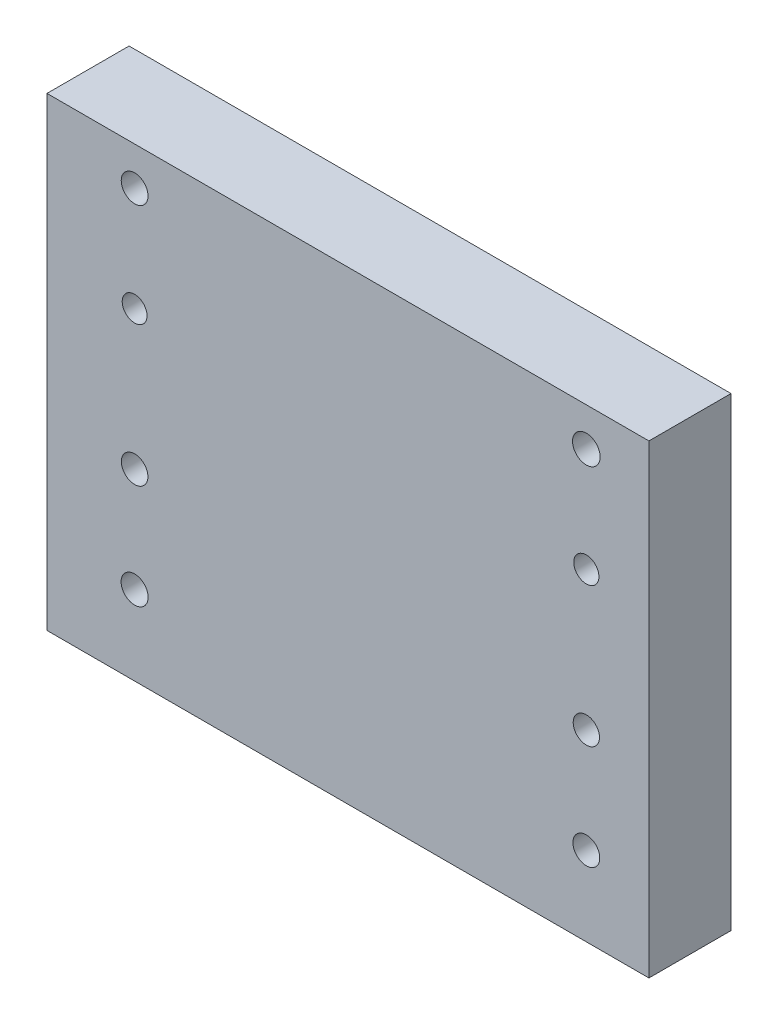
from build123d import *

# Parameters (mm, degrees)
ESQUISSE1_W             = 220
ESQUISSE1_H             = 170
BOSS_EXTRU_1_DEPTH      = 30
ESQUISSE2_R             = 4.903912754
ESQUISSE2_R_2           = 4.801609754
ESQUISSE2_R_3           = 4.59981141
ESQUISSE2_R_4           = 5.047191948
ESQUISSE2_R_5           = 4.896690608
ESQUISSE2_R_6           = 4.540130348
ESQUISSE2_R_7           = 4.855099262
ESQUISSE2_R_8           = 4.939659405
ENL_V_MAT_EXTRU_3_DEPTH = 30


with BuildPart() as part:
    # Esquisse1 → Boss.-Extru.1 (new body)
    with BuildSketch(Plane.XY):
        with Locations((110, 85)):
            Rectangle(ESQUISSE1_W, ESQUISSE1_H)
    extrude(amount=BOSS_EXTRU_1_DEPTH)

    # Esquisse2 → Enlèv. mat.-Extru.3 (cut)
    with BuildSketch(Plane(origin=(0, 0, 0), x_dir=(-1, 0, 0), z_dir=(0, 0, -1))):
        with Locations((-197.125064527, 28.976729825)):
            Circle(ESQUISSE2_R)
        with Locations((-197.125064527, 67.076729825)):
            Circle(ESQUISSE2_R_2)
        with Locations((-197.125064527, 117.876729825)):
            Circle(ESQUISSE2_R_3)
        with Locations((-197.125064527, 155.976729825)):
            Circle(ESQUISSE2_R_4)
        with Locations((-32.025064527, 155.976729825)):
            Circle(ESQUISSE2_R_5)
        with Locations((-32.025064527, 117.876729825)):
            Circle(ESQUISSE2_R_6)
        with Locations((-32.025064527, 67.076729825)):
            Circle(ESQUISSE2_R_7)
        with Locations((-32.025064527, 28.976729825)):
            Circle(ESQUISSE2_R_8)
    extrude(amount=-ENL_V_MAT_EXTRU_3_DEPTH, mode=Mode.SUBTRACT)


solid = part.part
